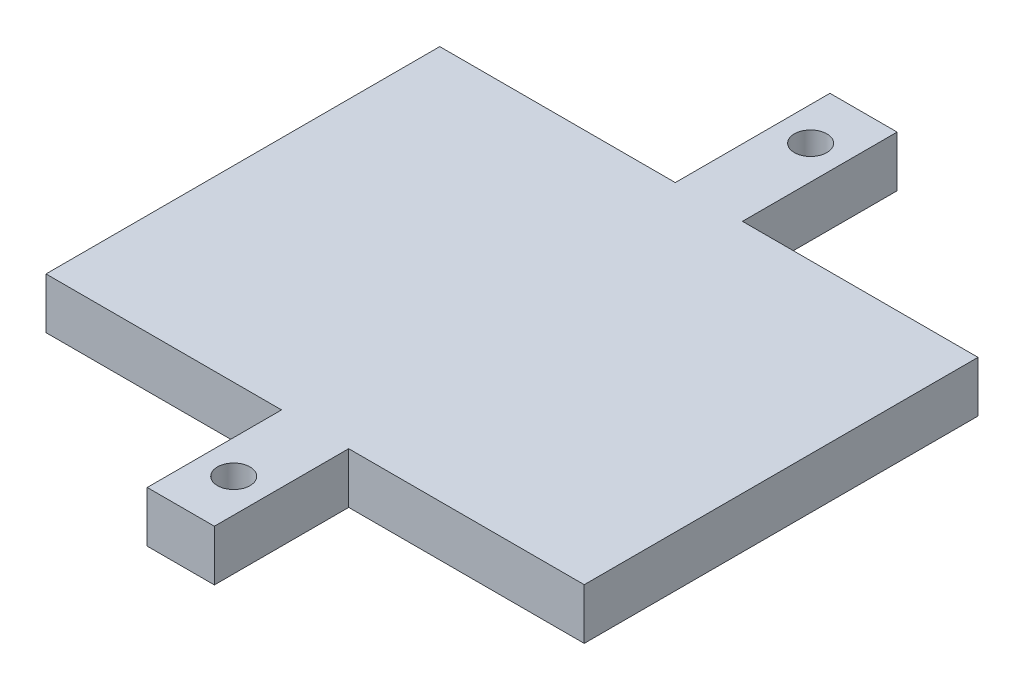
from build123d import *

# Parameters (mm, degrees)
BOSS_EXTRUDE1_DEPTH = 6.35
SKETCH2_R           = 2.032
CUT_EXTRUDE1_DEPTH  = 166.257012101


with BuildPart() as part:
    # Sketch1 → Boss-Extrude1 (new body)
    with BuildSketch(Plane(origin=(0, 0, 0), x_dir=(1, 0, 0), z_dir=(0, 1, 0))):
        Polygon((90.420598733, 29.997756713), (119.821098733, 29.997756713), (119.821098733, 49.301756713), (128.203098733, 49.301756713), (128.203098733, 29.997756713), (157.603598733, 29.997756713), (157.603598733, -19.151243287), (128.203098733, -19.151243287), (128.203098733, -35.915243287), (119.821098733, -35.915243287), (119.821098733, -19.151243287), (90.420598733, -19.151243287), align=None)
    extrude(amount=BOSS_EXTRUDE1_DEPTH)

    # Sketch2 → Cut-Extrude1 (cut, through all)
    with BuildSketch(Plane(origin=(0, 6.35, 0), x_dir=(1, 0, 0), z_dir=(0, 1, 0))):
        with Locations(Location((124.012098733, -29.311243287, 0), (0, 0, 270))):
            Circle(SKETCH2_R)
        with Locations(Location((124.012098733, 42.697756713, 0), (0, 0, 270))):
            Circle(SKETCH2_R)
    extrude(amount=-CUT_EXTRUDE1_DEPTH, mode=Mode.SUBTRACT)


solid = part.part
